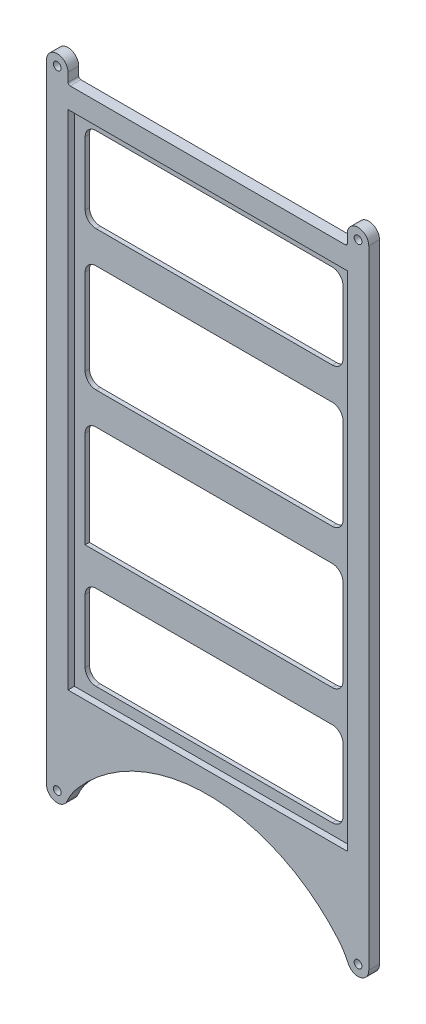
from build123d import *

# Parameters (mm, degrees)
SKETCH_2_R          = 1.8
EXTRUDE_1_DEPTH     = 5
SKETCH_3_W          = 130
SKETCH_3_H          = 234
CUT_EXTRUDE_1_DEPTH = 3
CUT_EXTRUDE_2_DEPTH = 302.492951825


with BuildPart() as part:
    # Эскиз2 → Бобышка-Вытянуть1 (new body)
    with BuildSketch(Plane.XY):
        with BuildLine():
            Line((-65, 5), (-65, 1))
            ThreePointArc((-65, 1), (-64.707106781, 0.292893219), (-64, 0))
            Line((-64, 0), (64, 0))
            ThreePointArc((64, 0), (64.707106781, 0.292893219), (65, 1))
            Line((65, 1), (65, 5))
            ThreePointArc((65, 5), (70, 10), (75, 5))
            Line((75, 5), (75, -287))
            ThreePointArc((75, -287), (71.029305531, -291.892906102), (65.42378795, -289.014518125))
            ThreePointArc((65.42378795, -289.014518125), (63.358638237, -285.125391065), (60.746425043, -281.58046584))
            ThreePointArc((60.746425043, -281.58046584), (0, -253.636895265), (-60.746425043, -281.58046584))
            ThreePointArc((-60.746425043, -281.58046584), (-63.358638237, -285.125391065), (-65.42378795, -289.014518125))
            ThreePointArc((-65.42378795, -289.014518125), (-71.029305531, -291.892906102), (-75, -287))
            Line((-75, -287), (-75, 5))
            ThreePointArc((-75, 5), (-70, 10), (-65, 5))
        make_face()
        with Locations((70, -287)):
            Circle(SKETCH_2_R, mode=Mode.SUBTRACT)
        with Locations((-70, -287)):
            Circle(SKETCH_2_R, mode=Mode.SUBTRACT)
        with Locations((-70, 5)):
            Circle(SKETCH_2_R, mode=Mode.SUBTRACT)
        with Locations((70, 5)):
            Circle(SKETCH_2_R, mode=Mode.SUBTRACT)
    extrude(amount=EXTRUDE_1_DEPTH)

    # Эскиз3 → Вырез-Вытянуть1 (cut)
    with BuildSketch(Plane.XY.offset(5)):
        with Locations((0, -127)):
            Rectangle(SKETCH_3_W, SKETCH_3_H)
    extrude(amount=-CUT_EXTRUDE_1_DEPTH, mode=Mode.SUBTRACT)

    # Эскиз4 → Вырез-Вытянуть2 (cut, through all)
    with BuildSketch(Plane.XY.offset(2)):
        with BuildLine():
            Line((-55, -15), (55, -15))
            ThreePointArc((55, -15), (58.535533906, -16.464466094), (60, -20))
            Line((60, -20), (60, -49.5))
            ThreePointArc((60, -49.5), (58.535533906, -53.035533906), (55, -54.5))
            Line((55, -54.5), (-55, -54.5))
            ThreePointArc((-55, -54.5), (-58.535533906, -53.035533906), (-60, -49.5))
            Line((-60, -49.5), (-60, -20))
            ThreePointArc((-60, -20), (-58.535533906, -16.464466094), (-55, -15))
        make_face()
        with BuildLine():
            Line((-55, -239), (55, -239))
            ThreePointArc((55, -239), (58.535533906, -237.535533906), (60, -234))
            Line((60, -234), (60, -204.5))
            ThreePointArc((60, -204.5), (58.535533906, -200.964466094), (55, -199.5))
            Line((55, -199.5), (-55, -199.5))
            ThreePointArc((-55, -199.5), (-58.535533906, -200.964466094), (-60, -204.5))
            Line((-60, -204.5), (-60, -234))
            ThreePointArc((-60, -234), (-58.535533906, -237.535533906), (-55, -239))
        make_face()
        with BuildLine():
            Line((55, -119.5), (-55, -119.5))
            ThreePointArc((-55, -119.5), (-58.535533906, -118.035533906), (-60, -114.5))
            Line((-60, -114.5), (-60, -74.5))
            ThreePointArc((-60, -74.5), (-58.535533906, -70.964466094), (-55, -69.5))
            Line((-55, -69.5), (55, -69.5))
            ThreePointArc((55, -69.5), (58.535533906, -70.964466094), (60, -74.5))
            Line((60, -74.5), (60, -114.5))
            ThreePointArc((60, -114.5), (58.535533906, -118.035533906), (55, -119.5))
        make_face()
        with BuildLine():
            Line((-60, -139.5), (-60, -184.5))
            Line((-60, -184.5), (55, -184.5))
            ThreePointArc((55, -184.5), (58.535533906, -183.035533906), (60, -179.5))
            Line((60, -179.5), (60, -139.5))
            ThreePointArc((60, -139.5), (58.535533906, -135.964466094), (55, -134.5))
            Line((55, -134.5), (-55, -134.5))
            ThreePointArc((-55, -134.5), (-58.535533906, -135.964466094), (-60, -139.5))
        make_face()
    extrude(amount=-CUT_EXTRUDE_2_DEPTH, mode=Mode.SUBTRACT)


solid = part.part
